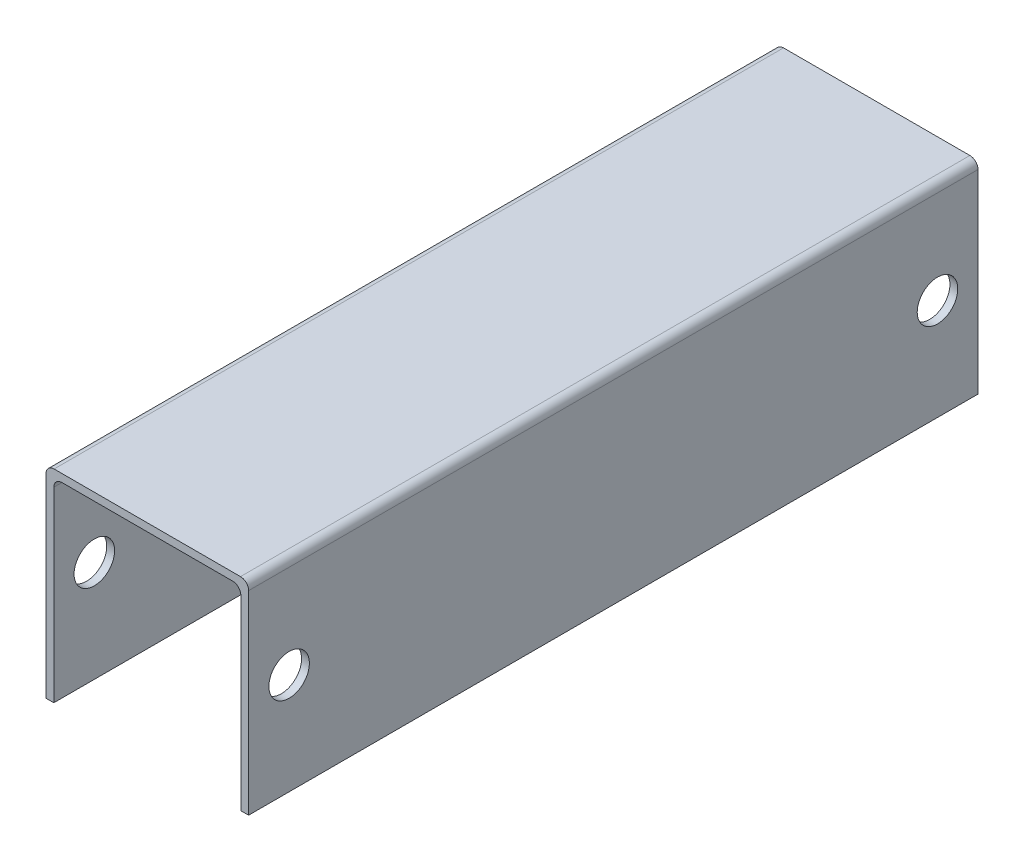
from build123d import *

# Parameters (mm, degrees)
BOSS_EXTRUDE1_DEPTH = 180
SKETCH2_R           = 5
CUT_EXTRUDE1_DEPTH  = 194.390796058
FILLET1_R           = 2


with BuildPart() as part:
    # Sketch1 → Boss-Extrude1 (new body)
    with BuildSketch(Plane.XY):
        Polygon((0, 0), (0, 50), (50, 50), (50, 0), (48.07222, 0), (48.07222, 48.07222), (1.92778, 48.07222), (1.92778, 0), align=None)
    extrude(amount=BOSS_EXTRUDE1_DEPTH)

    # Sketch2 → Cut-Extrude1 (cut, through all)
    with BuildSketch(Plane.ZY):
        with Locations((10, 25)):
            Circle(SKETCH2_R)
        with Locations((170, 25)):
            Circle(SKETCH2_R)
    extrude(amount=-CUT_EXTRUDE1_DEPTH, mode=Mode.SUBTRACT)

    # Fillet1
    fillet1_edges = [part.edges().sort_by_distance(p)[0] for p in [
        (0, 50, 90),
        (50, 50, 90),
        (48.07222, 48.07222, 90),
        (1.92778, 48.07222, 90),
    ]]
    fillet(fillet1_edges, radius=FILLET1_R)


solid = part.part
